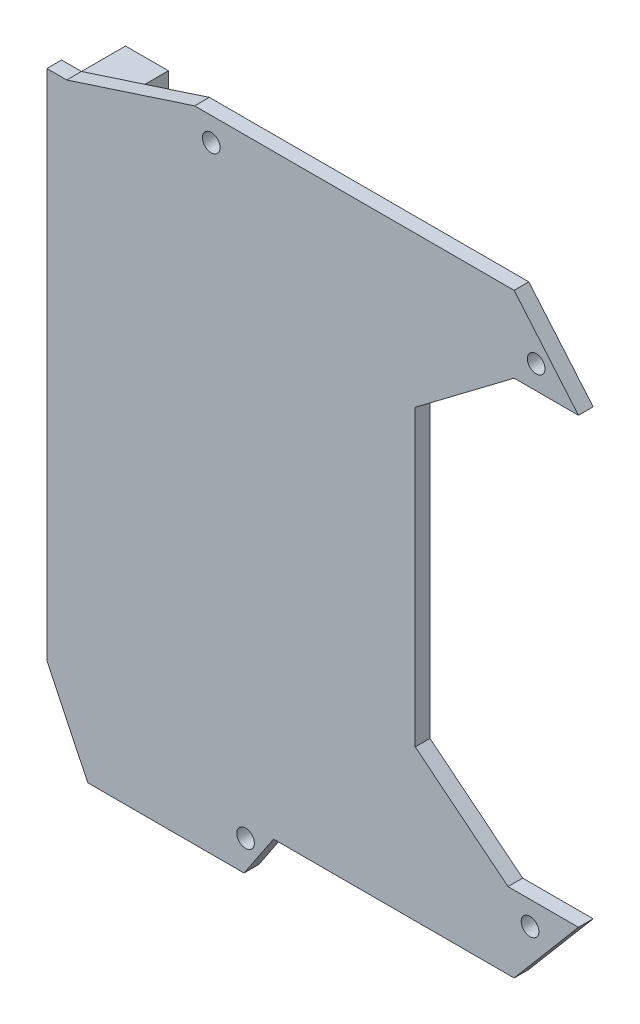
from build123d import *

# Parameters (mm, degrees)
SKETCH_1_R          = 1.2
EXTRUDE_1_DEPTH     = 2
SKETCH_2_W          = 5.828282036
SKETCH_2_H          = 6
EXTRUDE_3_DEPTH     = 6
SKETCH_4_R          = 1.5
CUT_EXTRUDE_1_DEPTH = 5.828282036


with BuildPart() as part:
    # 草图1 → 凸台-拉伸1 (new body)
    # profile 1 of 3: a face of its own
    with BuildSketch(Plane.XY):
        Polygon((-105.285311989, -8.55), (-141.174369577, -8.55), (-145.174369577, -14.55), (-161.297950566, -14.55), (-164.165207203, -8.55), (-165.3, -8.55), (-165.3, -4.7), (-168, -4.7), (-168, 65), (-165.3, 65), (-159.471717964, 65), (-149.4421323, 68.256733276), (-149.4421323, 63.85), (-141.4421323, 63.85), (-141.4421323, 68.85), (-104.45, 68.85), (-104.45, 60.3), (-117.895945033, 50.15), (-117.895945033, 10.15), (-105.285311989, 0), align=None)
    # profile 2 of 3: a face of its own
    with BuildSketch(Plane.XY):
        Polygon((-141.4421323, 63.85), (-141.4421323, 68.85), (-104.45, 68.85), (-104.45, 60.3), (-95.7, 60.3), (-104.45, 70.65), (-147.9, 70.65), (-165.3, 65), (-159.471717964, 65), (-149.4421323, 68.256733276), (-149.4421323, 63.85), align=None)
        with Locations((-101.45, 63.5)):
            Circle(SKETCH_1_R, mode=Mode.SUBTRACT)
        with Locations((-145.6421323, 67.45)):
            Circle(SKETCH_1_R, mode=Mode.SUBTRACT)
    # profile 3 of 3: a face of its own
    with BuildSketch(Plane.XY):
        Polygon((-105.285311989, 0), (-105.285311989, -8.55), (-141.174369577, -8.55), (-145.174369577, -14.55), (-161.297950566, -14.55), (-164.165207203, -8.55), (-165.3, -8.55), (-165.3, -4.7), (-168, -4.7), (-162.432743363, -16.35), (-141.174369577, -16.35), (-137.174369577, -10.35), (-104.45, -10.35), (-95.7, 0), align=None)
        with Locations((-140.974369577, -12.15)):
            Circle(SKETCH_1_R, mode=Mode.SUBTRACT)
        with Locations((-102.285311989, -3.2)):
            Circle(SKETCH_1_R, mode=Mode.SUBTRACT)
    extrude(amount=EXTRUDE_1_DEPTH)

    # 草图2 → 凸台-拉伸3 (add)
    with BuildSketch(Plane(origin=(0, 0, 0), x_dir=(-1, 0, 0), z_dir=(0, 0, -1))):
        with Locations((162.385858982, 62)):
            Rectangle(SKETCH_2_W, SKETCH_2_H)
        with Locations((162.385858982, -1.7)):
            Rectangle(SKETCH_2_W, SKETCH_2_H)
    extrude(amount=EXTRUDE_3_DEPTH)

    # 草图4 → 切除-拉伸1 (cut)
    with BuildSketch(Plane.ZY.offset(165.3)):
        with Locations(Location((-3.1, 61.9, 0), (0, 0, 270))):
            Circle(SKETCH_4_R)
        with Locations(Location((-3.1, -1.6, 0), (0, 0, 270))):
            Circle(SKETCH_4_R)
    extrude(amount=-CUT_EXTRUDE_1_DEPTH, mode=Mode.SUBTRACT)


solid = part.part
